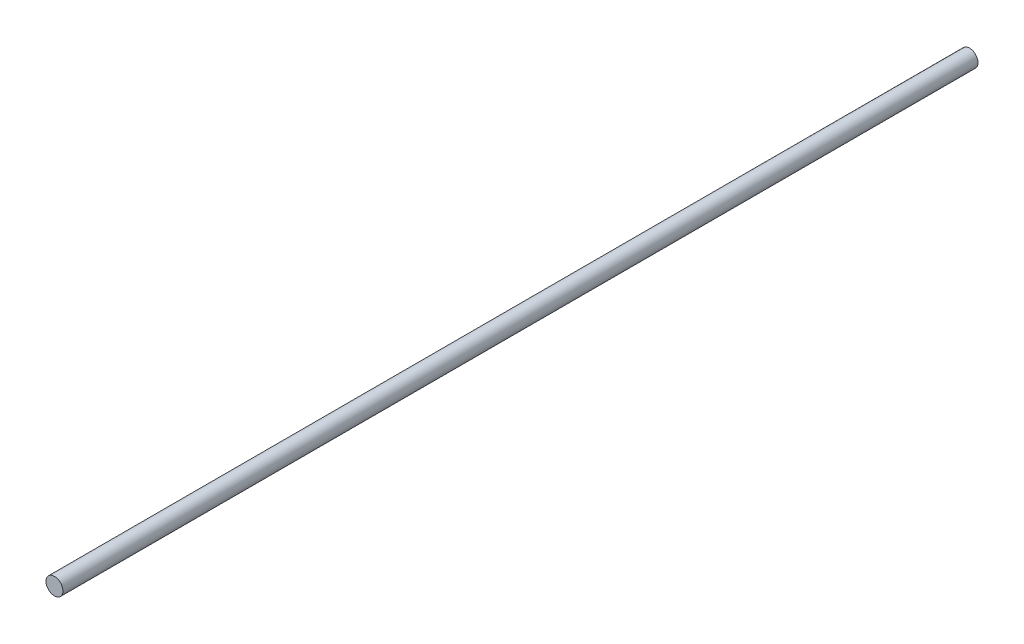
from build123d import *

# Parameters (mm, degrees)
SKETCH1_R           = 2
BOSS_EXTRUDE1_DEPTH = 108


with BuildPart() as part:
    # Sketch1 → Boss-Extrude1 (new, symmetric)
    with BuildSketch(Plane.XY):
        Circle(SKETCH1_R)
    extrude(amount=BOSS_EXTRUDE1_DEPTH, both=True)


solid = part.part
